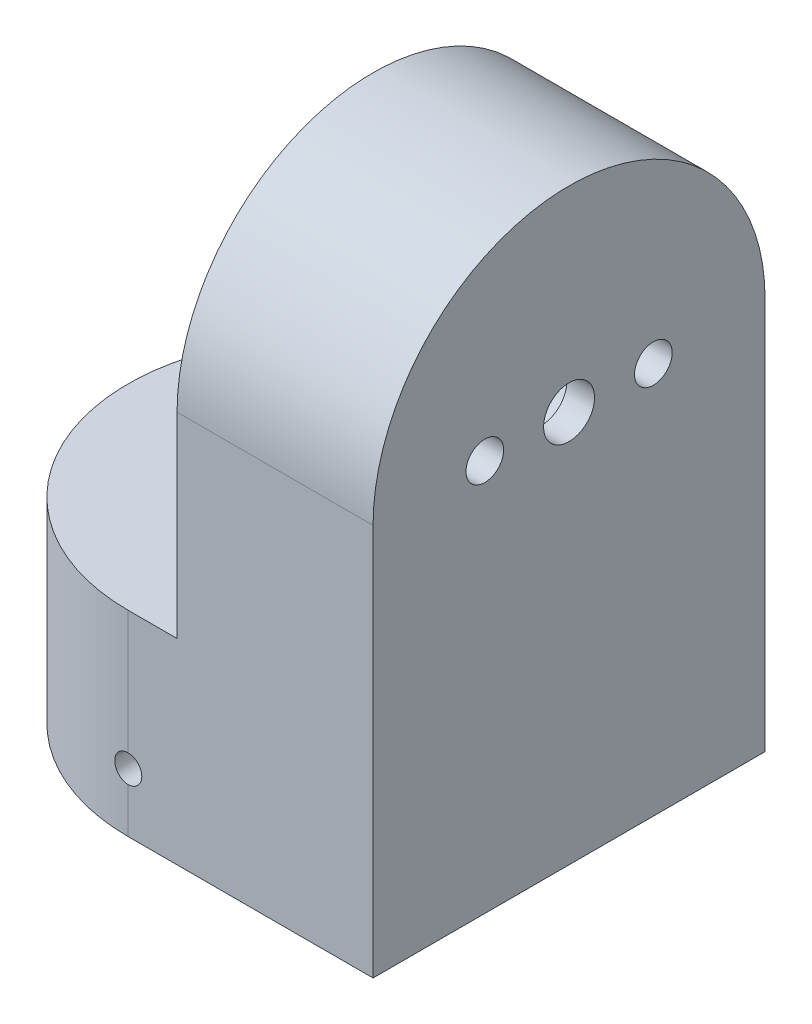
from build123d import *

# Parameters (mm, degrees)
SKETCH1_R           = 12.7
BOSS_EXTRUDE1_DEPTH = 12.7
SKETCH2_R           = 1.6256
CUT_EXTRUDE1_DEPTH  = 9.525
SKETCH3_R           = 9.525
CUT_EXTRUDE2_DEPTH  = 2.54
BOSS_EXTRUDE6_START = -12.7
BOSS_EXTRUDE6_DEPTH = 12.7
SKETCH15_R          = 12.7
BOSS_EXTRUDE8_DEPTH = 12.7
SKETCH17_R          = 1.651
CUT_EXTRUDE4_DEPTH  = 12.7
SKETCH18_R          = 3.81
CUT_EXTRUDE5_DEPTH  = 10.9027722
SKETCH19_R          = 8.255
CUT_EXTRUDE6_DEPTH  = 8.3627722
SKETCH20_R          = 9.525
CUT_EXTRUDE7_DEPTH  = 5.1877722
SKETCH21_R          = 1.2192
CUT_EXTRUDE8_DEPTH  = 4.3372278


with BuildPart() as part:
    # Sketch1 → Boss-Extrude1 (new body)
    with BuildSketch(Plane(origin=(0, 0, 0), x_dir=(1, 0, 0), z_dir=(0, 1, 0))):
        with Locations(Location((0, 0, 0), (0, 0, 270))):
            Circle(SKETCH1_R)
    extrude(amount=BOSS_EXTRUDE1_DEPTH)

    # Sketch2 → Cut-Extrude1 (cut)
    with BuildSketch(Plane.XZ):
        with Locations(Location((0, 0, 0), (0, 0, 270))):
            Circle(SKETCH2_R)
    extrude(amount=-CUT_EXTRUDE1_DEPTH, mode=Mode.SUBTRACT)

    # Sketch3 → Cut-Extrude2 (cut)
    with BuildSketch(Plane.XZ):
        with Locations(Location((0, 0, 0), (0, 0, 270))):
            Circle(SKETCH3_R)
    extrude(amount=-CUT_EXTRUDE2_DEPTH, mode=Mode.SUBTRACT)

    # Sketch14 → Boss-Extrude6 (add)
    with BuildSketch(Plane(origin=(0, 12.7, 0), x_dir=(1, 0, 0), z_dir=(0, 1, 0)).offset(BOSS_EXTRUDE6_START)):
        with BuildLine():
            Line((15.875, 12.7), (0, 12.7))
            ThreePointArc((0, 12.7), (8.980256121, 8.980256121), (12.7, 0))
            ThreePointArc((12.7, 0), (8.980256121, -8.980256121), (0, -12.7))
            Line((0, -12.7), (15.875, -12.7))
            Line((15.875, -12.7), (15.875, 12.7))
        make_face()
    extrude(amount=BOSS_EXTRUDE6_DEPTH)

    # Sketch5 → #2-56 Tapped Hole1 (revolve, cut)
    with BuildSketch(Plane(origin=(0, 3.81, 0), x_dir=(0, 1, 0), z_dir=(1, 0, 0))):
        Polygon((0, 0), (0, 13.74216509), (0.889, 13.208), (0.889, 0), align=None)
    revolve(axis=Axis((0, 3.81, -6.35), (0, 0, 1)), mode=Mode.SUBTRACT)

    # Sketch15 → Boss-Extrude8 (add)
    with BuildSketch(Plane(origin=(15.875, 0, 0), x_dir=(0, 0, -1), z_dir=(1, 0, 0))):
        with Locations((0, 25.4)):
            Circle(SKETCH15_R)
        with BuildLine():
            ThreePointArc((0, 12.7), (-8.980256121, 16.419743879), (-12.7, 25.4))
            Line((-12.7, 25.4), (-12.7, 12.7))
            Line((-12.7, 12.7), (0, 12.7))
        make_face()
        with BuildLine():
            Line((12.7, 12.7), (12.7, 25.4))
            ThreePointArc((12.7, 25.4), (8.980256121, 16.419743879), (0, 12.7))
            Line((0, 12.7), (12.7, 12.7))
        make_face()
    extrude(amount=-BOSS_EXTRUDE8_DEPTH)

    # Sketch17 → Cut-Extrude4 (cut)
    with BuildSketch(Plane.ZY.offset(-3.175)):
        with Locations((0, 25.4)):
            Circle(SKETCH17_R)
    extrude(amount=-CUT_EXTRUDE4_DEPTH, mode=Mode.SUBTRACT)

    # Sketch18 → Cut-Extrude5 (cut)
    with BuildSketch(Plane.ZY.offset(-3.175)):
        with Locations((0, 25.4)):
            Circle(SKETCH18_R)
    extrude(amount=-CUT_EXTRUDE5_DEPTH, mode=Mode.SUBTRACT)

    # Sketch19 → Cut-Extrude6 (cut)
    with BuildSketch(Plane.ZY.offset(-3.175)):
        with Locations((0, 25.4)):
            Circle(SKETCH19_R)
    extrude(amount=-CUT_EXTRUDE6_DEPTH, mode=Mode.SUBTRACT)

    # Sketch20 → Cut-Extrude7 (cut)
    with BuildSketch(Plane.ZY.offset(-3.175)):
        with Locations((0, 25.4)):
            Circle(SKETCH20_R)
    extrude(amount=-CUT_EXTRUDE7_DEPTH, mode=Mode.SUBTRACT)

    # Sketch21 → Cut-Extrude8 (cut)
    with BuildSketch(Plane.ZY.offset(-11.5377722)):
        with Locations((5.4599967, 25.4)):
            Circle(SKETCH21_R)
        with Locations((-5.4599967, 25.4)):
            Circle(SKETCH21_R)
    extrude(amount=-CUT_EXTRUDE8_DEPTH, mode=Mode.SUBTRACT)


solid = part.part
